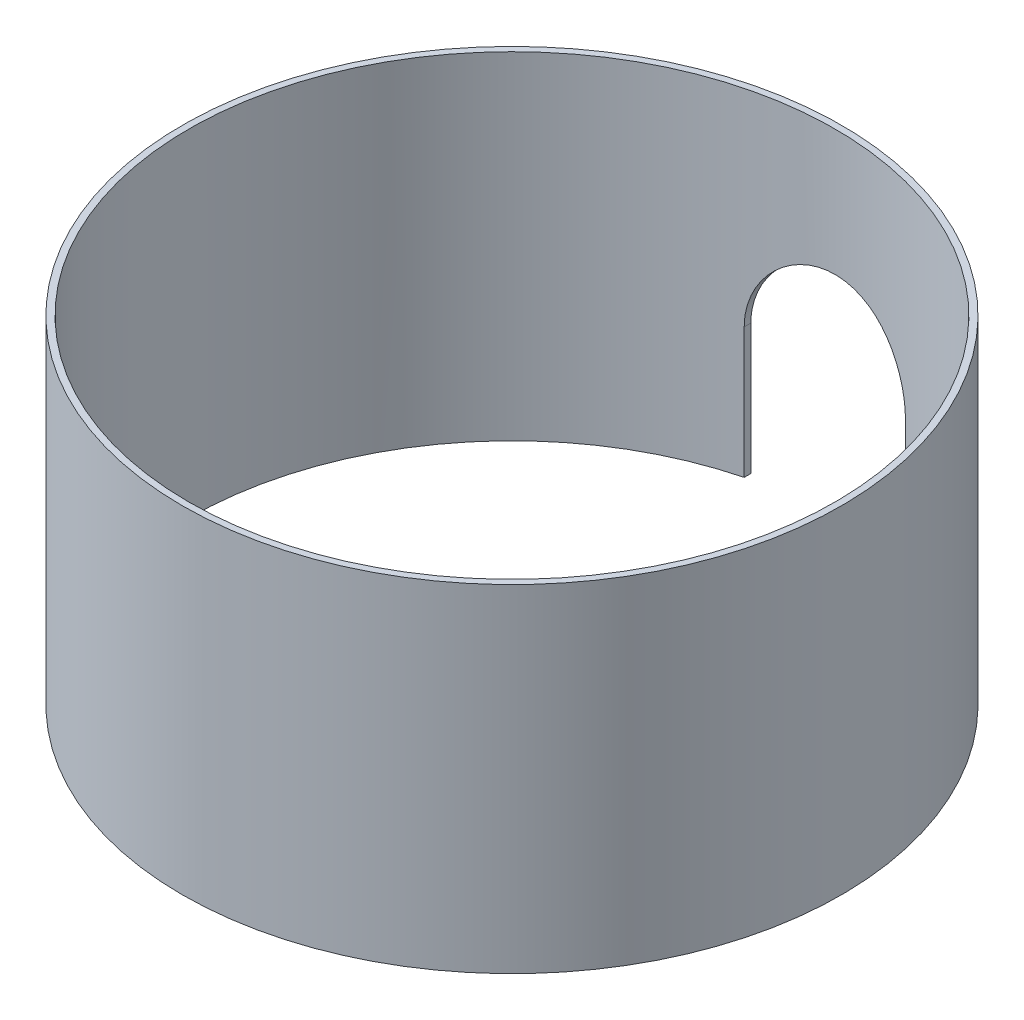
from build123d import *

# Parameters (mm, degrees)
SKETCH1_R           = 51.838
SKETCH1_R_2         = 50.822
BOSS_EXTRUDE1_DEPTH = 54
CUT_EXTRUDE1_DEPTH  = 53
CUT_EXTRUDE2_START  = -1
SKETCH3_R           = 51.838
SKETCH3_R_2         = 50.822
CUT_EXTRUDE2_DEPTH  = 1


with BuildPart() as part:
    # Sketch1 → Boss-Extrude1 (new body)
    with BuildSketch(Plane(origin=(0, 0, 0), x_dir=(1, 0, 0), z_dir=(0, 1, 0))):
        with Locations(Location((-43.858802719, -17.175645915, 0), (0, 0, 270))):
            Circle(SKETCH1_R)
        with Locations(Location((-43.858802719, -17.175645915, 0), (0, 0, 270))):
            Circle(SKETCH1_R_2, mode=Mode.SUBTRACT)
    extrude(amount=BOSS_EXTRUDE1_DEPTH)

    # Sketch2 → Cut-Extrude1 (cut)
    with BuildSketch(Plane.XY):
        with BuildLine():
            Line((-56.540802719, 20.5), (-56.540802719, -11.133422885))
            Line((-56.540802719, -11.133422885), (-31.176802719, -11.133422885))
            Line((-31.176802719, -11.133422885), (-31.176802719, 20.5))
            ThreePointArc((-31.176802719, 20.5), (-43.858802719, 33.182), (-56.540802719, 20.5))
        make_face()
    extrude(amount=-CUT_EXTRUDE1_DEPTH, mode=Mode.SUBTRACT)

    # Sketch3 → Cut-Extrude2 (cut)
    with BuildSketch(Plane(origin=(0, 54, 0), x_dir=(1, 0, 0), z_dir=(0, 1, 0)).offset(CUT_EXTRUDE2_START)):
        with Locations(Location((-43.858802719, -17.175645915, 0), (0, 0, 75.839039259))):
            Circle(SKETCH3_R)
        with Locations(Location((-43.858802719, -17.175645915, 0), (0, 0, 75.54984846))):
            Circle(SKETCH3_R_2, mode=Mode.SUBTRACT)
    extrude(amount=CUT_EXTRUDE2_DEPTH, mode=Mode.SUBTRACT)


solid = part.part
